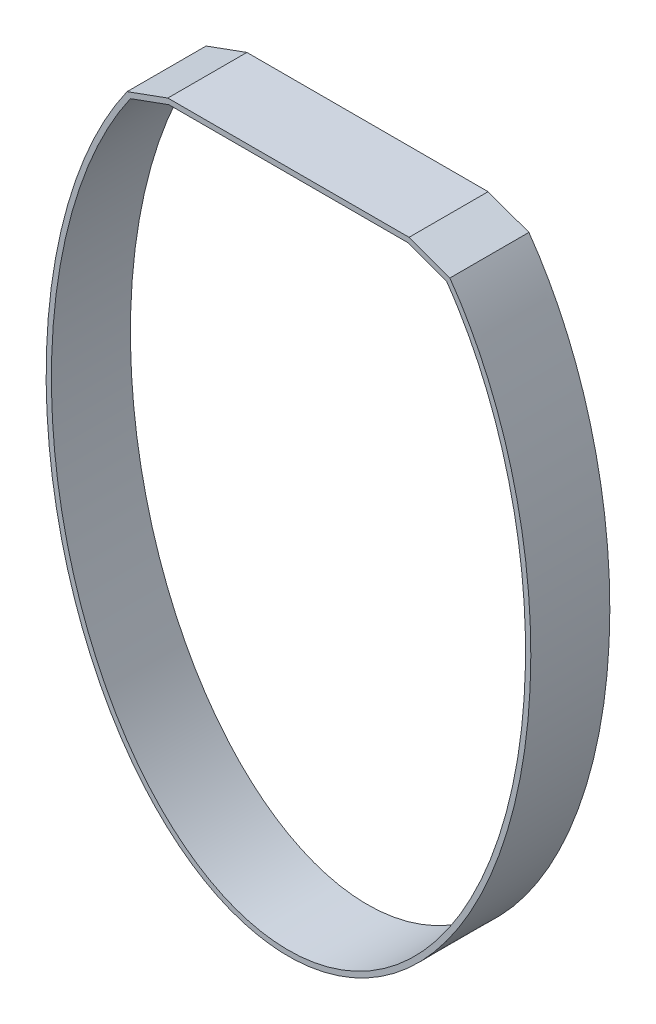
from build123d import *

# Parameters (mm, degrees)
BOSS_EXTRUDE1_DEPTH = 15


with BuildPart() as part:
    # Sketch1 → Boss-Extrude1 (new, symmetric)
    with BuildSketch(Plane.XY):
        with BuildLine():
            Line((45.785258764, 2), (61.272409514, -3.636861926))
            add(Edge.make_bspline(
                [(-61.272409514, -3.636861926), (-62.141806361, -4.861242653), (-63.826945596, -7.326884307), (-67.099904206, -12.490009632), (-70.944487791, -19.286021329), (-75.156607636, -27.967327696), (-80.201839156, -40.169702058), (-85.389123326, -56.475511939), (-89.688126639, -77.288460839), (-91.968421171, -98.880912031), (-92.25450497, -128.065641057), (-87.412618046, -164.053987534), (-73.764999065, -202.605649332), (-53.446551286, -233.084958595), (-28.143858105, -252.740530127), (0, -259.582882356), (28.143858105, -252.740530127), (53.446551286, -233.084958595), (73.764999065, -202.605649332), (87.412618046, -164.053987534), (92.25450497, -128.065641057), (91.968421171, -98.880912031), (89.688126639, -77.288460839), (85.389123326, -56.475511939), (80.201839156, -40.169702058), (75.156607636, -27.967327696), (70.944487791, -19.286021329), (67.099904206, -12.490009632), (63.826945596, -7.326884307), (62.141806361, -4.861242653), (61.272409514, -3.636861926)],
                knots=[0.724399077, 0.724399077, 0.724399077, 0.724399077, 0.762167727, 0.799936377, 0.875473676, 0.951010975, 1.026548274, 1.177622873, 1.328697471, 1.47977207, 1.630846668, 1.932995866, 2.235145063, 2.53729426, 2.839443457, 3.141592654, 3.443741851, 3.745891048, 4.048040245, 4.350189442, 4.652338639, 4.803413237, 4.954487836, 5.105562434, 5.256637033, 5.332174332, 5.407711631, 5.48324893, 5.52101758, 5.55878623, 5.55878623, 5.55878623, 5.55878623], degree=3))
            Line((-61.272409514, -3.636861926), (-45.785258764, 2))
            Line((-45.785258764, 2), (45.785258764, 2))
        make_face()
        with BuildLine():
            Line((-45.4326048, 0), (45.4326048, 0))
            Line((45.4326048, 0), (60, -5.30209828))
            add(Edge.make_bspline(
                [(-60, -5.30209828), (-235.623058987, -255.30209828), (0, -255.30209828), (235.623058987, -255.30209828), (60, -5.30209828)],
                knots=[0.729727656, 0.729727656, 0.729727656, 3.141592654, 3.141592654, 5.553457651, 5.553457651, 5.553457651], degree=2, weights=[1, 0.35682209, 1, 0.35682209, 1]))
            Line((-60, -5.30209828), (-45.4326048, 0))
        make_face(mode=Mode.SUBTRACT)
    extrude(amount=BOSS_EXTRUDE1_DEPTH, both=True)


solid = part.part
